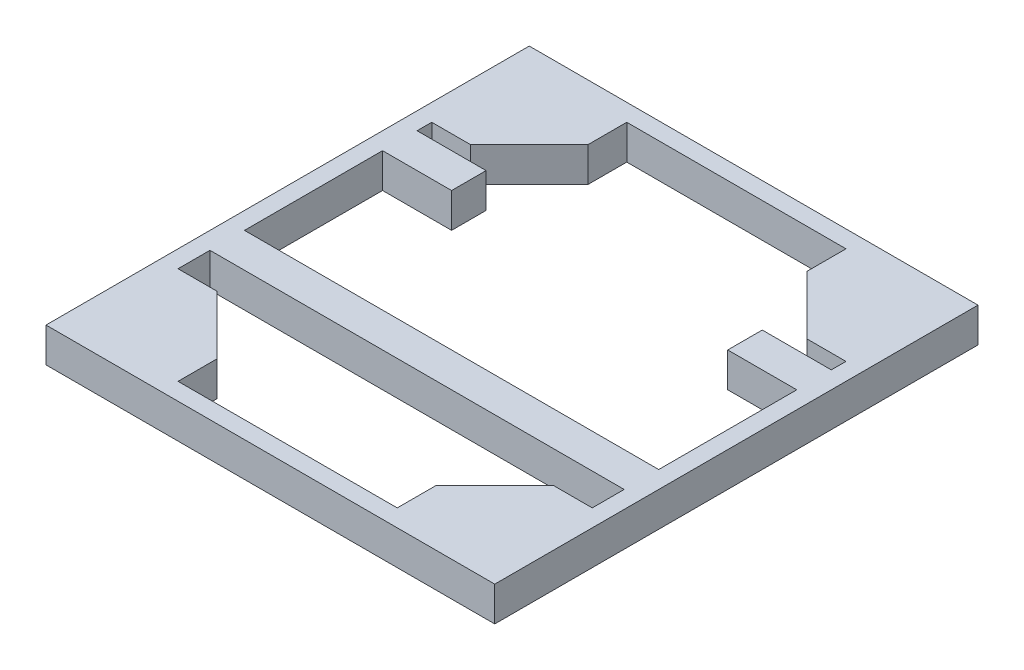
from build123d import *

# Parameters (mm, degrees)
SKETCH1_W           = 660.4
SKETCH1_H           = 711.2
SKETCH1_W_2         = 609.6
SKETCH1_H_2         = 660.4
BOSS_EXTRUDE1_DEPTH = 50.8
SKETCH2_W           = 609.6
SKETCH2_H           = 50.8
BOSS_EXTRUDE2_DEPTH = 50.8
SKETCH3_W           = 406.4
SKETCH3_H           = 50.8
CUT_EXTRUDE2_DEPTH  = 972.861224661


with BuildPart() as part:
    # Sketch1 → Boss-Extrude1 (new body)
    # profile 1 of 5: a face of its own
    with BuildSketch(Plane(origin=(0, 0, 0), x_dir=(1, 0, 0), z_dir=(0, 1, 0))):
        with Locations((330.2, 355.6)):
            Rectangle(SKETCH1_W, SKETCH1_H)
        with Locations((330.2, 355.6)):
            Rectangle(SKETCH1_W_2, SKETCH1_H_2, mode=Mode.SUBTRACT)
    # profile 2 of 5: a face of its own
    with BuildSketch(Plane(origin=(0, 0, 0), x_dir=(1, 0, 0), z_dir=(0, 1, 0))):
        Polygon((82.55, 168.89717139), (25.4, 168.89717139), (25.4, 25.4), (168.89717139, 25.4), (168.89717139, 82.55), align=None)
    # profile 3 of 5: a face of its own
    with BuildSketch(Plane(origin=(0, 0, 0), x_dir=(1, 0, 0), z_dir=(0, 1, 0))):
        Polygon((491.50282861, 82.55), (491.50282861, 25.4), (635, 25.4), (635, 168.89717139), (577.85, 168.89717139), align=None)
    # profile 4 of 5: a face of its own
    with BuildSketch(Plane(origin=(0, 0, 0), x_dir=(1, 0, 0), z_dir=(0, 1, 0))):
        Polygon((635, 685.8), (491.50282861, 685.8), (491.50282861, 628.65), (577.85, 542.30282861), (635, 542.30282861), align=None)
    # profile 5 of 5: a face of its own
    with BuildSketch(Plane(origin=(0, 0, 0), x_dir=(1, 0, 0), z_dir=(0, 1, 0))):
        Polygon((25.4, 542.30282861), (82.55, 542.30282861), (168.89717139, 628.65), (168.89717139, 685.8), (25.4, 685.8), align=None)
    extrude(amount=BOSS_EXTRUDE1_DEPTH)

    # Sketch2 → Boss-Extrude2 (add)
    with BuildSketch(Plane(origin=(0, 50.8, 0), x_dir=(1, 0, 0), z_dir=(0, 1, 0))):
        with Locations((330.2, 241.3)):
            Rectangle(SKETCH2_W, SKETCH2_H)
        with Locations((330.2, 495.3)):
            Rectangle(SKETCH2_W, SKETCH2_H)
    extrude(amount=-BOSS_EXTRUDE2_DEPTH)

    # Sketch3 → Cut-Extrude2 (cut, through all)
    with BuildSketch(Plane(origin=(0, 50.8, 0), x_dir=(1, 0, 0), z_dir=(0, 1, 0))):
        with Locations((330.2, 495.3)):
            Rectangle(SKETCH3_W, SKETCH3_H)
    extrude(amount=-CUT_EXTRUDE2_DEPTH, mode=Mode.SUBTRACT)


solid = part.part
